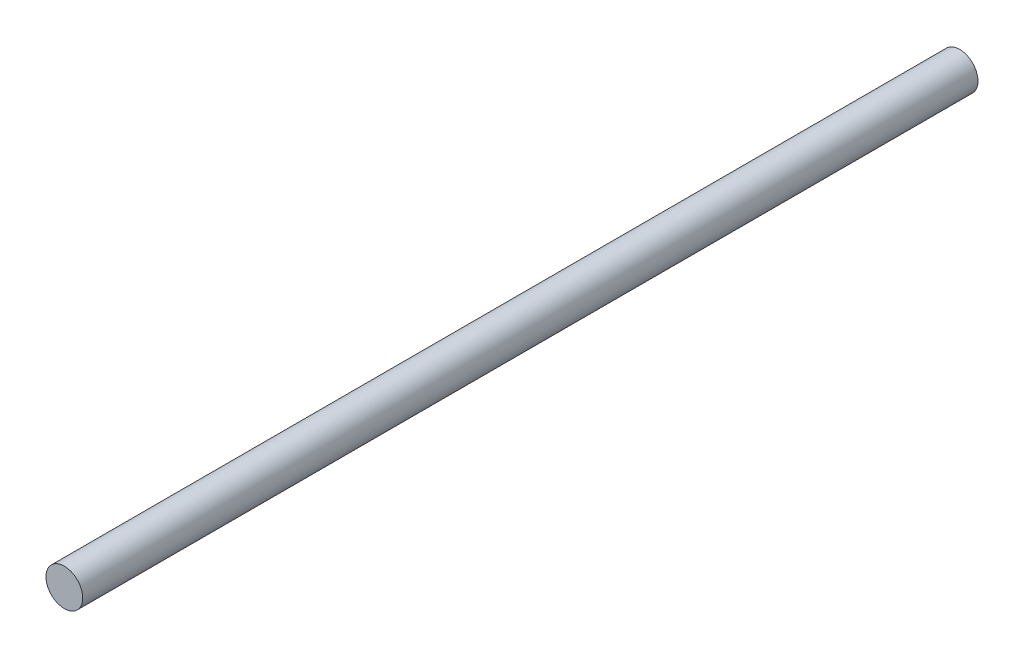
from build123d import *

# Parameters (mm, degrees)
ESBO_O1_R                = 1.5
RESSALTO_EXTRUS_O1_DEPTH = 73


with BuildPart() as part:
    # Esboço1 → Ressalto-extrusão1 (new body)
    with BuildSketch(Plane.XY):
        Circle(ESBO_O1_R)
    extrude(amount=RESSALTO_EXTRUS_O1_DEPTH)


solid = part.part
